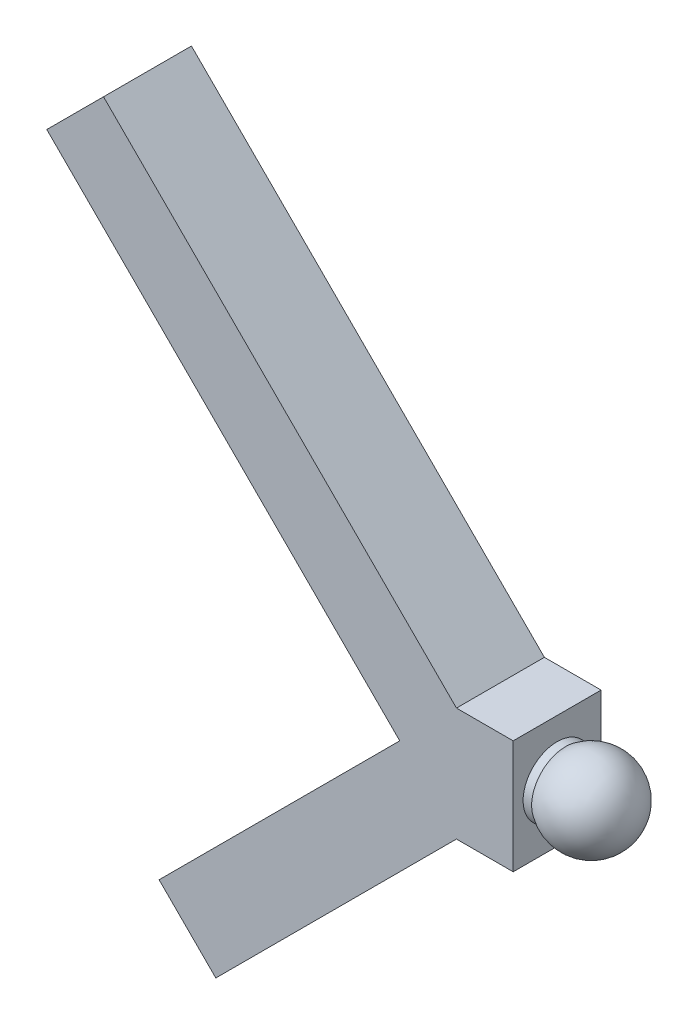
from build123d import *

# Parameters (mm, degrees)
BOSS_EXTRUDE3_DEPTH = 7.75
SKETCH4_R           = 3
BOSS_EXTRUDE4_DEPTH = 3


with BuildPart() as part:
    # Sketch3 → Boss-Extrude3 (new body)
    with BuildSketch(Plane.XY):
        Polygon((-2.5, 5), (2.5, 5), (2.5, -5), (-2.5, -5), (-23.713203436, -26.213203436), (-28.713203436, -21.213203436), (-7.5, 0), (-38.612698372, 31.112698372), (-33.612698372, 36.112698372), align=None)
    extrude(amount=BOSS_EXTRUDE3_DEPTH)

    # Sketch4 → Boss-Extrude4 (add)
    with BuildSketch(Plane(origin=(2.5, 0, 0), x_dir=(0, 0, -1), z_dir=(1, 0, 0))):
        with Locations(Location((-3.875, 0, 0), (0, 0, 90))):
            Circle(SKETCH4_R)
    extrude(amount=BOSS_EXTRUDE4_DEPTH)

    # Sketch5 → Revolve1 (revolve)
    with BuildSketch(Plane(origin=(5.5, 0, 0), x_dir=(0, 0, -1), z_dir=(1, 0, 0))):
        with BuildLine():
            Line((-3.875, 3.75), (-3.875, -3.75))
            ThreePointArc((-3.875, -3.75), (-7.625, 0), (-3.875, 3.75))
        make_face()
    revolve(axis=Axis((5.5, 4.135747614, 3.875), (0, -1, 0)))


solid = part.part
